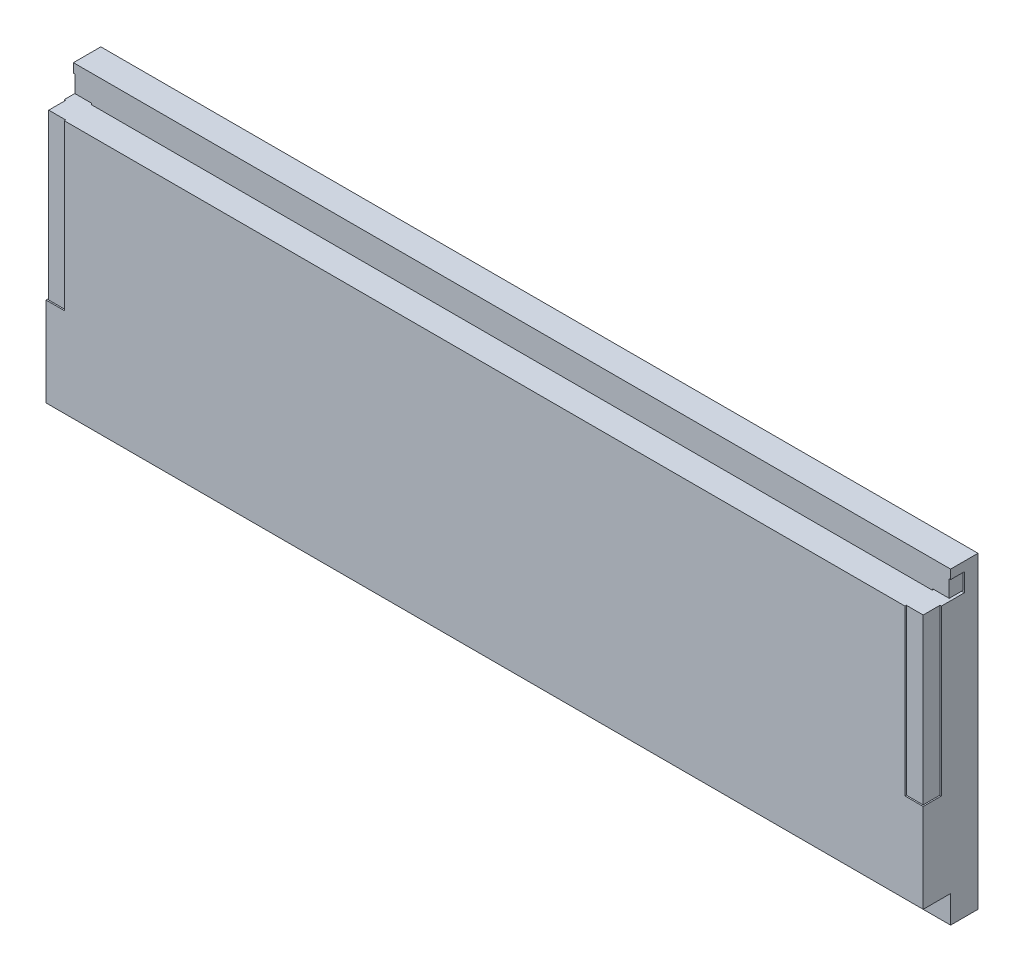
from build123d import *

# Parameters (mm, degrees)
SKETCH1_W           = 1920
SKETCH1_H           = 675
BOSS_EXTRUDE1_DEPTH = 120
SKETCH2_W           = 60
SKETCH2_H           = 60
CUT_EXTRUDE1_DEPTH  = 1954.127299999
CUT_EXTRUDE2_DEPTH  = 360
CUT_EXTRUDE3_DEPTH  = 30


with BuildPart() as part:
    # Sketch1 → Boss-Extrude1 (new body)
    with BuildSketch(Plane.XY):
        Rectangle(SKETCH1_W, SKETCH1_H)
    extrude(amount=BOSS_EXTRUDE1_DEPTH)

    # Sketch2 → Cut-Extrude1 (cut, through all)
    with BuildSketch(Plane(origin=(960, 0, 0), x_dir=(0, 0, -1), z_dir=(1, 0, 0))):
        with Locations((-90, 307.5)):
            Rectangle(SKETCH2_W, SKETCH2_H)
        with Locations((-90, -307.5)):
            Rectangle(SKETCH2_W, SKETCH2_H)
    extrude(amount=-CUT_EXTRUDE1_DEPTH, mode=Mode.SUBTRACT)

    # Sketch3 → Cut-Extrude2 (cut)
    with BuildSketch(Plane(origin=(0, 277.5, 0), x_dir=(1, 0, 0), z_dir=(0, 1, 0))):
        Polygon((-960, -120), (-920, -120), (-920, -117), (-957, -117), (-957, -80), (-960, -80), align=None)
    cut_extrude2 = extrude(amount=-CUT_EXTRUDE2_DEPTH, mode=Mode.SUBTRACT)

    # Sketch4 → Cut-Extrude3 (cut)
    with BuildSketch(Plane.XY.offset(60)):
        Polygon((-957, 280.5), (-920, 280.5), (-920, 277.5), (-960, 277.5), (-960, 317.5), (-957, 317.5), align=None)
    cut_extrude3 = extrude(amount=-CUT_EXTRUDE3_DEPTH, mode=Mode.SUBTRACT)

    # Mirror1: Cut-Extrude2, Cut-Extrude3 across plane
    add(cut_extrude2.mirror(Plane(origin=(0, 0, 0), x_dir=(0, 0, 1), z_dir=(1, 0, 0))), mode=Mode.SUBTRACT)
    add(cut_extrude3.mirror(Plane(origin=(0, 0, 0), x_dir=(0, 0, 1), z_dir=(1, 0, 0))), mode=Mode.SUBTRACT)


solid = part.part
